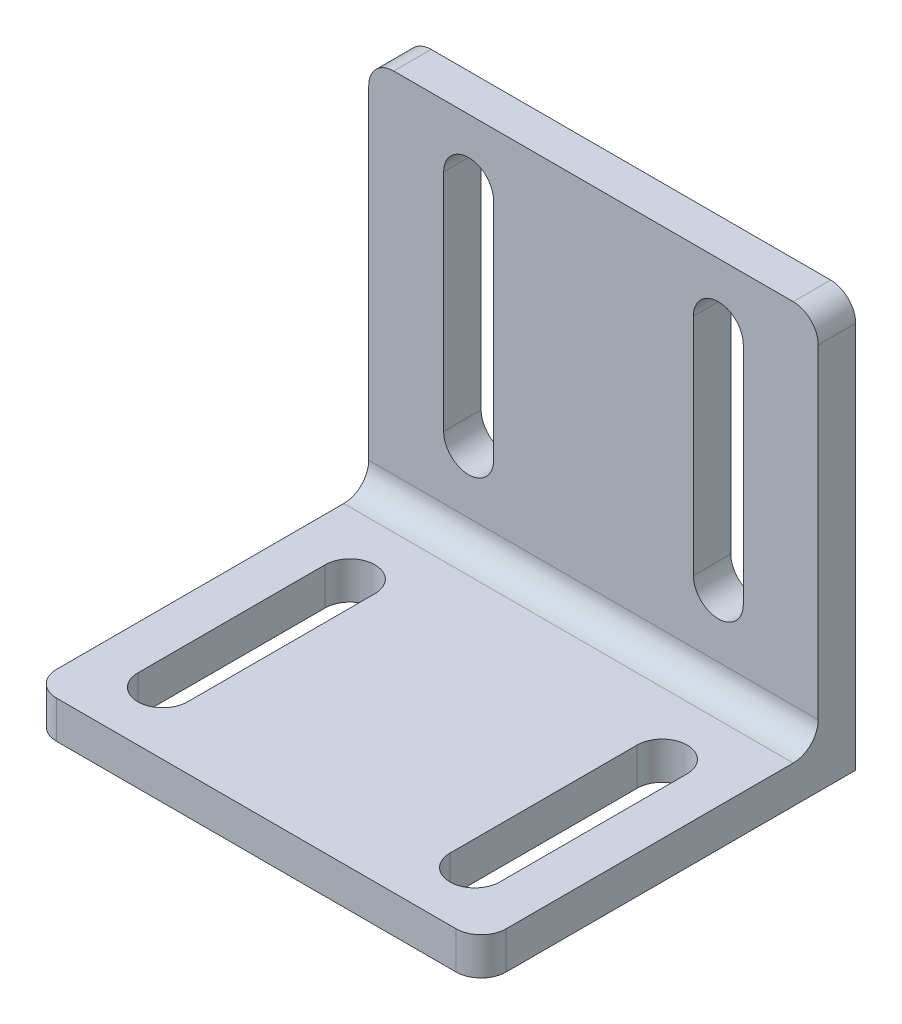
from build123d import *

# Parameters (mm, degrees)
EXTRUDE_1_DEPTH          = 3
SKETCH_2_W               = 36
SKETCH_2_H               = 3
EXTRUDE_2_DEPTH          = 30
CUT_EXTRUDE_1_DEPTH      = 47.281745862
CUT_EXTRUDE_1_DEPTH_BACK = 47.281745862
FILLET_1_R               = 2
FILLET_2_R               = 2


with BuildPart() as part:
    # 草图1 → 凸台-拉伸1 (new body)
    with BuildSketch(Plane(origin=(0, 0, 0), x_dir=(1, 0, 0), z_dir=(0, 1, 0))):
        Polygon((0, 9.489130435), (-18, 9.489130435), (-18, -20.510869565), (0, -20.510869565), (18, -20.510869565), (18, 9.489130435), align=None)
        with BuildLine():
            Line((-10.5, -0.510869565), (-10.5, -15.510869565))
            ThreePointArc((-10.5, -15.510869565), (-12.5, -17.510869565), (-14.5, -15.510869565))
            Line((-14.5, -15.510869565), (-14.5, -0.510869565))
            ThreePointArc((-14.5, -0.510869565), (-12.5, 1.489130435), (-10.5, -0.510869565))
        make_face(mode=Mode.SUBTRACT)
        with BuildLine():
            Line((14.5, -0.510869565), (14.5, -15.510869565))
            ThreePointArc((14.5, -15.510869565), (12.5, -17.510869565), (10.5, -15.510869565))
            Line((10.5, -15.510869565), (10.5, -0.510869565))
            ThreePointArc((10.5, -0.510869565), (12.5, 1.489130435), (14.5, -0.510869565))
        make_face(mode=Mode.SUBTRACT)
    extrude(amount=EXTRUDE_1_DEPTH)

    # 草图2 → 凸台-拉伸2 (add)
    with BuildSketch(Plane(origin=(0, 3, 0), x_dir=(1, 0, 0), z_dir=(0, 1, 0))):
        with Locations((0, 7.989130435)):
            Rectangle(SKETCH_2_W, SKETCH_2_H)
    extrude(amount=EXTRUDE_2_DEPTH)

    # 草图3 → 切除-拉伸1 (cut, two sides: drawn at the far end of the back side and taken through both)
    with BuildSketch(Plane.XY.offset(-6.489130435).offset(-CUT_EXTRUDE_1_DEPTH_BACK)):
        with BuildLine():
            Line((-8, 28), (-8, 10))
            ThreePointArc((-8, 10), (-10, 8), (-12, 10))
            Line((-12, 10), (-12, 28))
            ThreePointArc((-12, 28), (-10, 30), (-8, 28))
        make_face()
        with BuildLine():
            Line((8, 28), (8, 10))
            ThreePointArc((8, 10), (10, 8), (12, 10))
            Line((12, 10), (12, 28))
            ThreePointArc((12, 28), (10, 30), (8, 28))
        make_face()
    extrude(amount=CUT_EXTRUDE_1_DEPTH + CUT_EXTRUDE_1_DEPTH_BACK, mode=Mode.SUBTRACT)

    # 圆角1
    fillet_1_edges = [part.edges().sort_by_distance(p)[0] for p in [
        (18, 1.5, 20.510869565),
        (-18, 1.5, 20.510869565),
        (-18, 33, -7.989130435),
        (18, 33, -7.989130435),
    ]]
    fillet(fillet_1_edges, radius=FILLET_1_R)

    # 圆角2
    fillet_2_edges = [part.edges().sort_by_distance(p)[0] for p in [
        (0, 3, -6.489130435),
    ]]
    fillet(fillet_2_edges, radius=FILLET_2_R)


solid = part.part
